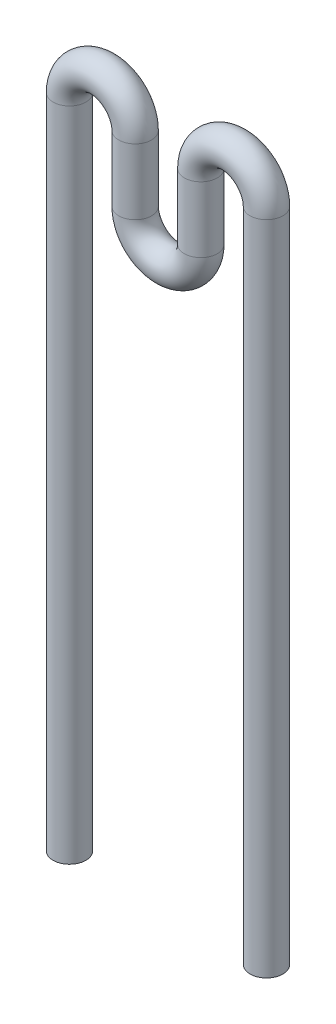
from build123d import *

# Parameters (mm, degrees)
SKETCH8_R = 5


with BuildPart() as part:
    # Sweep3: sweep along a path in Sketch1
    with BuildLine(Plane.XY) as sweep3_path:
        Line((0, 0), (0, 200))
        ThreePointArc((0, 200), (10, 210), (20, 200))
        Line((20, 200), (20, 180))
        ThreePointArc((20, 180), (30, 170), (40, 180))
        Line((40, 180), (40, 200))
        ThreePointArc((40, 200), (50, 210), (60, 200))
        Line((60, 200), (60, 0))
    # Sketch8 → Sweep3 (sweep)
    with BuildSketch(Plane(origin=(0, 0, 0), x_dir=(1, 0, 0), z_dir=(0, 1, 0))):
        Circle(SKETCH8_R)
    sweep(path=sweep3_path.line)


solid = part.part
